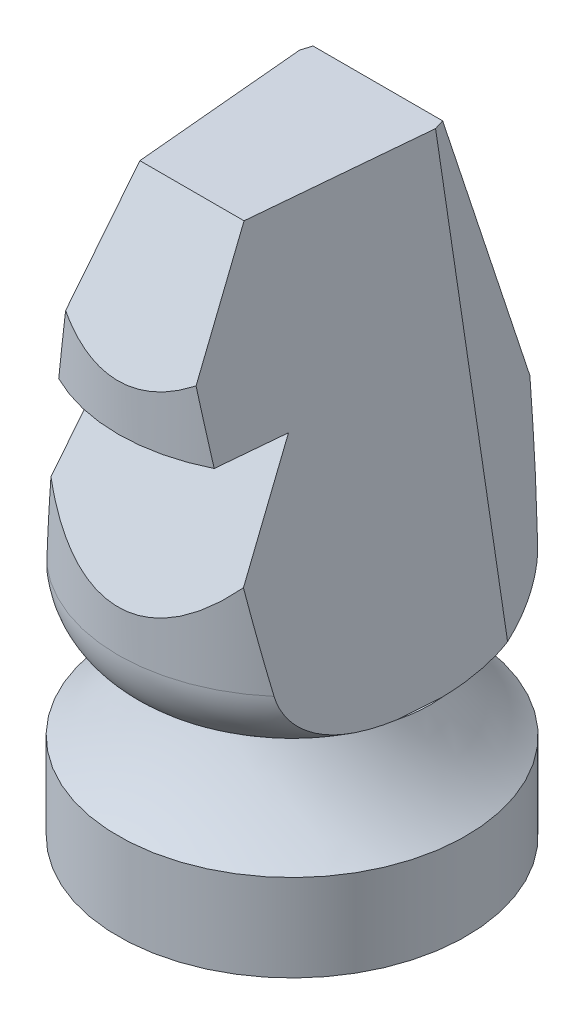
from build123d import *

# Parameters (mm, degrees)
CUT_EXTRUDE1_DEPTH      = 51
CUT_EXTRUDE2_DEPTH      = 58.445626587
CUT_EXTRUDE2_DEPTH_BACK = 58.445626587
SCALE_1_SCALE           = 0.6


with BuildPart() as part:
    # Sketch1 → Revolve1 (revolve)
    with BuildSketch(Plane(origin=(0, 0, 0), x_dir=(0, 0, -1), z_dir=(1, 0, 0)), mode=Mode.PRIVATE) as revolve1_sk:
        with BuildLine():
            Line((-20, -10), (-20, -20))
            Line((-20, -20), (0, -20))
            Line((0, -20), (0, 0))
            Line((0, 0), (0, 50))
            Line((0, 50), (-20, 50))
            Line((-20, 50), (-20, 8))
            ThreePointArc((-20, 8), (-17.656854249, 2.343145751), (-12, 0))
            ThreePointArc((-12, 0), (-15.348827212, -5.520938231), (-20, -10))
        make_face()
    revolve(revolve1_sk.sketch.rotate(Axis((0, -20, 0), (0, 1, 0)), 180), axis=Axis((0, -20, 0), (0, 1, 0)))

    # Sketch4 → Cut-Extrude1 (cut)
    with BuildSketch(Plane(origin=(-8.550503583, 48.49231552, 0), x_dir=(0, 0, -1), z_dir=(0.17364817766692414, -0.9848077530122091, 0))):
        with BuildLine():
            add(Edge.make_bspline(
                [(1.59e-07, 28.378563944), (-15.257193416, 28.378564063), (-19.289037435, 13.887286477)],
                knots=[4.712388972, 4.712388972, 4.712388972, 6.015750233, 6.015750233, 6.015750233], degree=2, weights=[1, 0.79506558, 1]))
            Line((-19.289037435, 13.887286477), (8.678255984, 16.378563944))
            Line((8.678255984, 16.378563944), (19.498892761, 13.063772103))
            add(Edge.make_bspline(
                [(19.498892761, 13.063772103), (15.950697723, 28.378563819), (1.59e-07, 28.378563944)],
                knots=[3.365916951, 3.365916951, 3.365916951, 4.712388972, 4.712388972, 4.712388972], degree=2, weights=[1, 0.781808048, 1]))
        make_face()
    cut_extrude1 = extrude(amount=CUT_EXTRUDE1_DEPTH, mode=Mode.SUBTRACT)

    # Mirror1: Cut-Extrude1 across plane
    add(cut_extrude1.mirror(Plane(origin=(0, 0, 0), x_dir=(0, 0, 1), z_dir=(1, 0, 0))), mode=Mode.SUBTRACT)

    # Sketch5 → Cut-Extrude2 (cut, two sides: drawn at the far end of the back side and taken through both)
    with BuildSketch(Plane(origin=(0, 0, 0), x_dir=(0, 0, -1), z_dir=(1, 0, 0)).offset(-CUT_EXTRUDE2_DEPTH_BACK)):
        Polygon((-24.056341891, 5.761102159), (-10.062007697, 30), (-23.062007697, 30), (-1.700047737, 67), (5.299952263, 67), (20.243066063, 11.231540074), (36.223701355, 75.285993596), (-11.110548582, 82.293611227), (-55.649834593, 36.467288671), align=None)
    extrude(amount=CUT_EXTRUDE2_DEPTH + CUT_EXTRUDE2_DEPTH_BACK, mode=Mode.SUBTRACT)


with BuildPart() as part_1:
    # 缩放比例1: scaled about (0, 0, 0)
    add(part.part.scale(SCALE_1_SCALE))


solid = part_1.part
